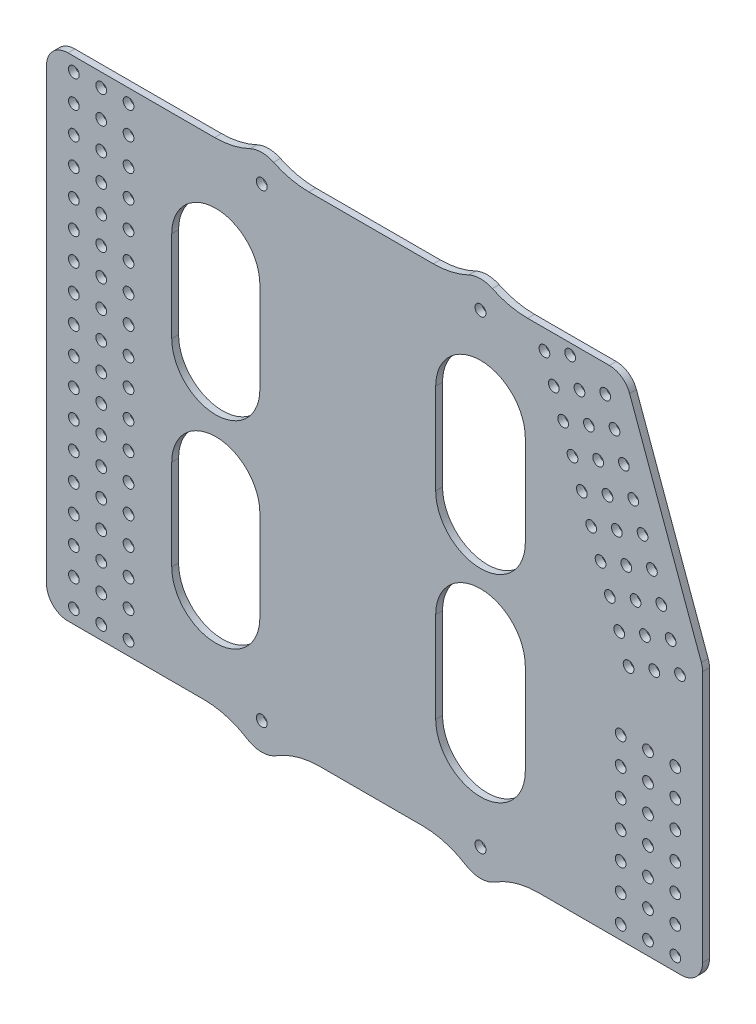
from build123d import *

# Parameters (mm, degrees)
SKETCH3_R           = 2.4892
SKETCH3_R_2         = 14.2875
BOSS_EXTRUDE3_DEPTH = 3.175
FILLET2_R           = 10
BOSS_EXTRUDE5_START = -3.175
SKETCH5_R           = 14.2875
SKETCH5_R_2         = 2.4892
BOSS_EXTRUDE5_DEPTH = 3.175
SKETCH6_R           = 2.54
CUT_EXTRUDE1_DEPTH  = 3.175
BOSS_EXTRUDE6_DEPTH = 3.175


with BuildPart() as part:
    # Sketch3 → Boss-Extrude3 (new body)
    with BuildSketch(Plane.XY):
        Polygon((-62.034734806, 275.060295422), (206.435304788, 275.060295422), (242.765265194, 175.244549557), (242.765265194, 46.460295422), (-62.034734806, 46.460295422), align=None)
        with Locations((123.22406409, 114.608841068)):
            Circle(SKETCH3_R, mode=Mode.SUBTRACT)
        with Locations(Location((87.05446409, 114.608841068, 0), (0, 0, 180))):
            Circle(SKETCH3_R, mode=Mode.SUBTRACT)
        with Locations((-49.334734806, 268.710295422)):
            Circle(SKETCH3_R, mode=Mode.SUBTRACT)
        with Locations((-49.334734806, 90.910295422)):
            Circle(SKETCH3_R, mode=Mode.SUBTRACT)
        with Locations((-36.634734806, 268.710295422)):
            Circle(SKETCH3_R, mode=Mode.SUBTRACT)
        with Locations((-23.934734806, 268.710295422)):
            Circle(SKETCH3_R, mode=Mode.SUBTRACT)
        with Locations((-36.634734806, 256.010295422)):
            Circle(SKETCH3_R, mode=Mode.SUBTRACT)
        with Locations((-23.934734806, 256.010295422)):
            Circle(SKETCH3_R, mode=Mode.SUBTRACT)
        with Locations((-36.634734806, 243.310295422)):
            Circle(SKETCH3_R, mode=Mode.SUBTRACT)
        with Locations((-23.934734806, 243.310295422)):
            Circle(SKETCH3_R, mode=Mode.SUBTRACT)
        with Locations((-36.634734806, 230.610295422)):
            Circle(SKETCH3_R, mode=Mode.SUBTRACT)
        with Locations((-23.934734806, 230.610295422)):
            Circle(SKETCH3_R, mode=Mode.SUBTRACT)
        with Locations((-36.634734806, 217.910295422)):
            Circle(SKETCH3_R, mode=Mode.SUBTRACT)
        with Locations((-23.934734806, 217.910295422)):
            Circle(SKETCH3_R, mode=Mode.SUBTRACT)
        with Locations((-36.634734806, 205.210295422)):
            Circle(SKETCH3_R, mode=Mode.SUBTRACT)
        with Locations((-23.934734806, 205.210295422)):
            Circle(SKETCH3_R, mode=Mode.SUBTRACT)
        with Locations((-36.634734806, 192.510295422)):
            Circle(SKETCH3_R, mode=Mode.SUBTRACT)
        with Locations((-23.934734806, 192.510295422)):
            Circle(SKETCH3_R, mode=Mode.SUBTRACT)
        with Locations((-36.634734806, 179.810295422)):
            Circle(SKETCH3_R, mode=Mode.SUBTRACT)
        with Locations((-23.934734806, 179.810295422)):
            Circle(SKETCH3_R, mode=Mode.SUBTRACT)
        with Locations((-36.634734806, 167.110295422)):
            Circle(SKETCH3_R, mode=Mode.SUBTRACT)
        with Locations((-23.934734806, 167.110295422)):
            Circle(SKETCH3_R, mode=Mode.SUBTRACT)
        with Locations((-36.634734806, 154.410295422)):
            Circle(SKETCH3_R, mode=Mode.SUBTRACT)
        with Locations((-23.934734806, 154.410295422)):
            Circle(SKETCH3_R, mode=Mode.SUBTRACT)
        with Locations((-36.634734806, 141.710295422)):
            Circle(SKETCH3_R, mode=Mode.SUBTRACT)
        with Locations((-23.934734806, 141.710295422)):
            Circle(SKETCH3_R, mode=Mode.SUBTRACT)
        with Locations((-36.634734806, 129.010295422)):
            Circle(SKETCH3_R, mode=Mode.SUBTRACT)
        with Locations((-23.934734806, 129.010295422)):
            Circle(SKETCH3_R, mode=Mode.SUBTRACT)
        with Locations((-36.634734806, 116.310295422)):
            Circle(SKETCH3_R, mode=Mode.SUBTRACT)
        with Locations((-23.934734806, 116.310295422)):
            Circle(SKETCH3_R, mode=Mode.SUBTRACT)
        with Locations((-36.634734806, 103.610295422)):
            Circle(SKETCH3_R, mode=Mode.SUBTRACT)
        with Locations((-23.934734806, 103.610295422)):
            Circle(SKETCH3_R, mode=Mode.SUBTRACT)
        with Locations((-36.634734806, 90.910295422)):
            Circle(SKETCH3_R, mode=Mode.SUBTRACT)
        with Locations((-23.934734806, 90.910295422)):
            Circle(SKETCH3_R, mode=Mode.SUBTRACT)
        with Locations((-49.334734806, 256.010295422)):
            Circle(SKETCH3_R, mode=Mode.SUBTRACT)
        with Locations((-49.334734806, 243.310295422)):
            Circle(SKETCH3_R, mode=Mode.SUBTRACT)
        with Locations((-49.334734806, 230.610295422)):
            Circle(SKETCH3_R, mode=Mode.SUBTRACT)
        with Locations((-49.334734806, 217.910295422)):
            Circle(SKETCH3_R, mode=Mode.SUBTRACT)
        with Locations((-49.334734806, 205.210295422)):
            Circle(SKETCH3_R, mode=Mode.SUBTRACT)
        with Locations((-49.334734806, 192.510295422)):
            Circle(SKETCH3_R, mode=Mode.SUBTRACT)
        with Locations((-49.334734806, 179.810295422)):
            Circle(SKETCH3_R, mode=Mode.SUBTRACT)
        with Locations((-49.334734806, 167.110295422)):
            Circle(SKETCH3_R, mode=Mode.SUBTRACT)
        with Locations((-49.334734806, 154.410295422)):
            Circle(SKETCH3_R, mode=Mode.SUBTRACT)
        with Locations((-49.334734806, 141.710295422)):
            Circle(SKETCH3_R, mode=Mode.SUBTRACT)
        with Locations((-49.334734806, 129.010295422)):
            Circle(SKETCH3_R, mode=Mode.SUBTRACT)
        with Locations((-49.334734806, 116.310295422)):
            Circle(SKETCH3_R, mode=Mode.SUBTRACT)
        with Locations((-49.334734806, 103.610295422)):
            Circle(SKETCH3_R, mode=Mode.SUBTRACT)
        with Locations((169.26865969, 265.77786594)):
            Circle(SKETCH3_R, mode=Mode.SUBTRACT)
        with Locations((181.202755974, 270.121521761)):
            Circle(SKETCH3_R, mode=Mode.SUBTRACT)
        with Locations((197.480508078, 262.531081297)):
            Circle(SKETCH3_R, mode=Mode.SUBTRACT)
        with Locations((173.61231551, 253.843769656)):
            Circle(SKETCH3_R, mode=Mode.SUBTRACT)
        with Locations((185.546411794, 258.187425477)):
            Circle(SKETCH3_R, mode=Mode.SUBTRACT)
        with Locations((201.824163899, 250.596985013)):
            Circle(SKETCH3_R, mode=Mode.SUBTRACT)
        with Locations((177.955971331, 241.909673372)):
            Circle(SKETCH3_R, mode=Mode.SUBTRACT)
        with Locations((189.890067615, 246.253329193)):
            Circle(SKETCH3_R, mode=Mode.SUBTRACT)
        with Locations((206.167819719, 238.662888729)):
            Circle(SKETCH3_R, mode=Mode.SUBTRACT)
        with Locations((182.299627151, 229.975577088)):
            Circle(SKETCH3_R, mode=Mode.SUBTRACT)
        with Locations((194.233723435, 234.319232909)):
            Circle(SKETCH3_R, mode=Mode.SUBTRACT)
        with Locations((210.511475539, 226.728792445)):
            Circle(SKETCH3_R, mode=Mode.SUBTRACT)
        with Locations((186.643282971, 218.041480804)):
            Circle(SKETCH3_R, mode=Mode.SUBTRACT)
        with Locations((198.577379255, 222.385136625)):
            Circle(SKETCH3_R, mode=Mode.SUBTRACT)
        with Locations((214.855131359, 214.794696161)):
            Circle(SKETCH3_R, mode=Mode.SUBTRACT)
        with Locations((190.986938791, 206.10738452)):
            Circle(SKETCH3_R, mode=Mode.SUBTRACT)
        with Locations((202.921035075, 210.451040341)):
            Circle(SKETCH3_R, mode=Mode.SUBTRACT)
        with Locations((219.19878718, 202.860599877)):
            Circle(SKETCH3_R, mode=Mode.SUBTRACT)
        with Locations((195.330594612, 194.173288236)):
            Circle(SKETCH3_R, mode=Mode.SUBTRACT)
        with Locations((207.264690896, 198.516944057)):
            Circle(SKETCH3_R, mode=Mode.SUBTRACT)
        with Locations((223.542443, 190.926503593)):
            Circle(SKETCH3_R, mode=Mode.SUBTRACT)
        with Locations((199.674250432, 182.239191952)):
            Circle(SKETCH3_R, mode=Mode.SUBTRACT)
        with Locations((211.608346716, 186.582847773)):
            Circle(SKETCH3_R, mode=Mode.SUBTRACT)
        with Locations((227.88609882, 178.992407309)):
            Circle(SKETCH3_R, mode=Mode.SUBTRACT)
        with Locations((204.017906252, 170.305095668)):
            Circle(SKETCH3_R, mode=Mode.SUBTRACT)
        with Locations((215.952002536, 174.648751489)):
            Circle(SKETCH3_R, mode=Mode.SUBTRACT)
        with Locations((232.22975464, 167.058311025)):
            Circle(SKETCH3_R, mode=Mode.SUBTRACT)
        with Locations((208.361562072, 158.370999384)):
            Circle(SKETCH3_R, mode=Mode.SUBTRACT)
        with Locations((220.295658356, 162.714655205)):
            Circle(SKETCH3_R, mode=Mode.SUBTRACT)
        with Locations((204.665265194, 129.010295422)):
            Circle(SKETCH3_R, mode=Mode.SUBTRACT)
        with Locations((217.365265194, 129.010295422)):
            Circle(SKETCH3_R, mode=Mode.SUBTRACT)
        with Locations((230.065265194, 129.010295422)):
            Circle(SKETCH3_R, mode=Mode.SUBTRACT)
        with Locations((204.665265194, 116.310295422)):
            Circle(SKETCH3_R, mode=Mode.SUBTRACT)
        with Locations((217.365265194, 116.310295422)):
            Circle(SKETCH3_R, mode=Mode.SUBTRACT)
        with Locations((230.065265194, 116.310295422)):
            Circle(SKETCH3_R, mode=Mode.SUBTRACT)
        with Locations((204.665265194, 103.610295422)):
            Circle(SKETCH3_R, mode=Mode.SUBTRACT)
        with Locations((217.365265194, 103.610295422)):
            Circle(SKETCH3_R, mode=Mode.SUBTRACT)
        with Locations((230.065265194, 103.610295422)):
            Circle(SKETCH3_R, mode=Mode.SUBTRACT)
        with Locations((204.665265194, 90.910295422)):
            Circle(SKETCH3_R, mode=Mode.SUBTRACT)
        with Locations((217.365265194, 90.910295422)):
            Circle(SKETCH3_R, mode=Mode.SUBTRACT)
        with Locations((230.065265194, 90.910295422)):
            Circle(SKETCH3_R, mode=Mode.SUBTRACT)
        with Locations((23.601611853, 185.85256672)):
            Circle(SKETCH3_R_2, mode=Mode.SUBTRACT)
        with Locations((52.142163008, 151.05639055)):
            Circle(SKETCH3_R_2, mode=Mode.SUBTRACT)
        with Locations((23.601611853, 116.25656672)):
            Circle(SKETCH3_R_2, mode=Mode.SUBTRACT)
        with Locations((105.13926409, 145.139641068)):
            Circle(SKETCH3_R_2, mode=Mode.SUBTRACT)
        with Locations((104.944740556, 224.82726801)):
            Circle(SKETCH3_R_2, mode=Mode.SUBTRACT)
        with Locations((144.142354475, 181.392565924)):
            Circle(SKETCH3_R_2, mode=Mode.SUBTRACT)
        with Locations((85.284021432, 241.01081705)):
            Circle(SKETCH3_R, mode=Mode.SUBTRACT)
        with Locations((23.601611853, 141.65656672)):
            Circle(SKETCH3_R, mode=Mode.SUBTRACT)
        with Locations((45.598657109, 128.95656672)):
            Circle(SKETCH3_R, mode=Mode.SUBTRACT)
        with Locations((45.598657109, 103.55656672)):
            Circle(SKETCH3_R, mode=Mode.SUBTRACT)
        with Locations((23.601611853, 90.85656672)):
            Circle(SKETCH3_R, mode=Mode.SUBTRACT)
        with Locations((1.604566597, 103.55656672)):
            Circle(SKETCH3_R, mode=Mode.SUBTRACT)
        with Locations((1.604566597, 128.95656672)):
            Circle(SKETCH3_R, mode=Mode.SUBTRACT)
        with Locations((23.601611853, 211.25256672)):
            Circle(SKETCH3_R, mode=Mode.SUBTRACT)
        with Locations((45.598657109, 198.55256672)):
            Circle(SKETCH3_R, mode=Mode.SUBTRACT)
        with Locations((45.598657109, 173.15256672)):
            Circle(SKETCH3_R, mode=Mode.SUBTRACT)
        with Locations((23.601611853, 160.45256672)):
            Circle(SKETCH3_R, mode=Mode.SUBTRACT)
        with Locations((1.604566597, 173.15256672)):
            Circle(SKETCH3_R, mode=Mode.SUBTRACT)
        with Locations((1.604566597, 198.55256672)):
            Circle(SKETCH3_R, mode=Mode.SUBTRACT)
        with Locations(Location((123.22406409, 175.670441068, 0), (0, 0, 180))):
            Circle(SKETCH3_R, mode=Mode.SUBTRACT)
        with Locations((87.05446409, 175.670441068)):
            Circle(SKETCH3_R, mode=Mode.SUBTRACT)
        with Locations((124.606520638, 208.84902209)):
            Circle(SKETCH3_R, mode=Mode.SUBTRACT)
        with Locations((-49.334734806, 78.210295422)):
            Circle(SKETCH3_R, mode=Mode.SUBTRACT)
        with Locations((-36.634734806, 78.210295422)):
            Circle(SKETCH3_R, mode=Mode.SUBTRACT)
        with Locations((-23.934734806, 78.210295422)):
            Circle(SKETCH3_R, mode=Mode.SUBTRACT)
        with Locations((-49.334734806, 65.510295422)):
            Circle(SKETCH3_R, mode=Mode.SUBTRACT)
        with Locations((-36.634734806, 65.510295422)):
            Circle(SKETCH3_R, mode=Mode.SUBTRACT)
        with Locations((-23.934734806, 65.510295422)):
            Circle(SKETCH3_R, mode=Mode.SUBTRACT)
        with Locations((-49.334734806, 52.810295422)):
            Circle(SKETCH3_R, mode=Mode.SUBTRACT)
        with Locations((-36.634734806, 52.810295422)):
            Circle(SKETCH3_R, mode=Mode.SUBTRACT)
        with Locations((-23.934734806, 52.810295422)):
            Circle(SKETCH3_R, mode=Mode.SUBTRACT)
        with Locations((204.665265194, 78.210295422)):
            Circle(SKETCH3_R, mode=Mode.SUBTRACT)
        with Locations((217.365265194, 78.210295422)):
            Circle(SKETCH3_R, mode=Mode.SUBTRACT)
        with Locations((230.065265194, 78.210295422)):
            Circle(SKETCH3_R, mode=Mode.SUBTRACT)
        with Locations((204.665265194, 65.510295422)):
            Circle(SKETCH3_R, mode=Mode.SUBTRACT)
        with Locations((217.365265194, 65.510295422)):
            Circle(SKETCH3_R, mode=Mode.SUBTRACT)
        with Locations((230.065265194, 65.510295422)):
            Circle(SKETCH3_R, mode=Mode.SUBTRACT)
        with Locations((204.665265194, 52.810295422)):
            Circle(SKETCH3_R, mode=Mode.SUBTRACT)
        with Locations((217.365265194, 52.810295422)):
            Circle(SKETCH3_R, mode=Mode.SUBTRACT)
        with Locations((230.065265194, 52.810295422)):
            Circle(SKETCH3_R, mode=Mode.SUBTRACT)
    extrude(amount=BOSS_EXTRUDE3_DEPTH)

    # Fillet2
    fillet2_edges = [part.edges().sort_by_distance(p)[0] for p in [
        (-62.034734806, 275.060295422, 1.5875),
        (206.435304788, 275.060295422, 1.5875),
        (242.765265194, 175.244549557, 1.5875),
        (242.765265194, 46.460295422, 1.5875),
        (-62.034734806, 46.460295422, 1.5875),
    ]]
    fillet(fillet2_edges, radius=FILLET2_R)

    # Sketch5 → Boss-Extrude5 (add)
    with BuildSketch(Plane.XY.offset(3.175).offset(BOSS_EXTRUDE5_START)):
        with Locations((23.601611853, 185.85256672)):
            Circle(SKETCH5_R)
        with Locations((23.601611853, 211.25256672)):
            Circle(SKETCH5_R_2)
        with Locations((45.598657109, 198.55256672)):
            Circle(SKETCH5_R_2)
        with Locations((1.604566597, 198.55256672)):
            Circle(SKETCH5_R_2)
        with Locations((1.604566597, 173.15256672)):
            Circle(SKETCH5_R_2)
        with Locations((23.601611853, 160.45256672)):
            Circle(SKETCH5_R_2)
        with Locations((45.598657109, 173.15256672)):
            Circle(SKETCH5_R_2)
        with Locations((23.601611853, 116.25656672)):
            Circle(SKETCH5_R)
        with Locations((1.604566597, 128.95656672)):
            Circle(SKETCH5_R_2)
        with Locations((23.601611853, 141.65656672)):
            Circle(SKETCH5_R_2)
        with Locations((45.598657109, 128.95656672)):
            Circle(SKETCH5_R_2)
        with Locations((1.604566597, 103.55656672)):
            Circle(SKETCH5_R_2)
        with Locations((23.601611853, 90.85656672)):
            Circle(SKETCH5_R_2)
        with Locations((45.598657109, 103.55656672)):
            Circle(SKETCH5_R_2)
        with Locations((52.142163008, 151.05639055)):
            Circle(SKETCH5_R)
        with Locations((105.13926409, 145.139641068)):
            Circle(SKETCH5_R)
        with Locations((87.05446409, 114.608841068)):
            Circle(SKETCH5_R_2)
        with Locations((123.22406409, 114.608841068)):
            Circle(SKETCH5_R_2)
        with Locations((87.05446409, 175.670441068)):
            Circle(SKETCH5_R_2)
        with Locations((123.22406409, 175.670441068)):
            Circle(SKETCH5_R_2)
        with Locations((144.142354475, 181.392565924)):
            Circle(SKETCH5_R)
        with Locations((104.944740556, 224.82726801)):
            Circle(SKETCH5_R)
        with Locations((124.606520638, 208.84902209)):
            Circle(SKETCH5_R_2)
        with Locations((85.284021432, 241.01081705)):
            Circle(SKETCH5_R_2)
    extrude(amount=BOSS_EXTRUDE5_DEPTH)

    # Sketch6 → Cut-Extrude1 (cut)
    with BuildSketch(Plane.XY.offset(3.175)):
        with Locations((37.965265194, 267.319051793)):
            Circle(SKETCH6_R)
        with Locations((139.565265194, 267.319051793)):
            Circle(SKETCH6_R)
        with Locations(Location((139.565265194, 51.419051793, 0), (0, 0, 180))):
            Circle(SKETCH6_R)
        with Locations(Location((37.965265194, 51.419051793, 0), (0, 0, 180))):
            Circle(SKETCH6_R)
        with BuildLine():
            Line((-3.86420078, 184.234054626), (-3.86420078, 226.372258652))
            ThreePointArc((-3.86420078, 226.372258652), (16.60292689, 246.839386322), (37.070054559, 226.372258652))
            Line((37.070054559, 226.372258652), (37.070054559, 184.234054626))
            ThreePointArc((37.070054559, 184.234054626), (16.60292689, 163.766926957), (-3.86420078, 184.234054626))
        make_face()
        with BuildLine():
            Line((118.756182344, 184.234054626), (118.756182344, 226.372258652))
            ThreePointArc((118.756182344, 226.372258652), (139.565265194, 247.181341502), (160.374348044, 226.372258652))
            Line((160.374348044, 226.372258652), (160.374348044, 184.234054626))
            ThreePointArc((160.374348044, 184.234054626), (139.565265194, 163.424971777), (118.756182344, 184.234054626))
        make_face()
        with BuildLine():
            Line((118.756182344, 134.504048959), (118.756182344, 92.365844933))
            ThreePointArc((118.756182344, 92.365844933), (139.565265194, 71.556762084), (160.374348044, 92.365844933))
            Line((160.374348044, 92.365844933), (160.374348044, 134.504048959))
            ThreePointArc((160.374348044, 134.504048959), (139.565265194, 155.313131809), (118.756182344, 134.504048959))
        make_face()
        with BuildLine():
            Line((-3.86420078, 134.504048959), (-3.86420078, 92.365844933))
            ThreePointArc((-3.86420078, 92.365844933), (16.60292689, 71.898717264), (37.070054559, 92.365844933))
            Line((37.070054559, 92.365844933), (37.070054559, 134.504048959))
            ThreePointArc((37.070054559, 134.504048959), (16.60292689, 154.971176629), (-3.86420078, 134.504048959))
        make_face()
    extrude(amount=-CUT_EXTRUDE1_DEPTH, mode=Mode.SUBTRACT)

    # Sketch7 → Boss-Extrude6 (add)
    with BuildSketch(Plane.XY.offset(3.175)):
        with BuildLine():
            ThreePointArc((43.438040898, 278.7793627), (51.43922885, 276.001692537), (59.85636801, 275.060295422))
            Line((59.85636801, 275.060295422), (16.074162378, 275.060295422))
            ThreePointArc((16.074162378, 275.060295422), (24.491301538, 276.001692537), (32.49248949, 278.7793627))
            ThreePointArc((32.49248949, 278.7793627), (37.965265194, 280.019051793), (43.438040898, 278.7793627))
        make_face()
        with BuildLine():
            ThreePointArc((145.038040898, 278.7793627), (153.03922885, 276.001692537), (161.45636801, 275.060295422))
            Line((161.45636801, 275.060295422), (117.674162378, 275.060295422))
            ThreePointArc((117.674162378, 275.060295422), (126.091301538, 276.001692537), (134.09248949, 278.7793627))
            ThreePointArc((134.09248949, 278.7793627), (139.565265194, 280.019051793), (145.038040898, 278.7793627))
        make_face()
        with BuildLine():
            ThreePointArc((31.226461981, 40.6543627), (37.965265194, 38.719051793), (44.704068407, 40.6543627))
            ThreePointArc((44.704068407, 40.6543627), (54.403681082, 44.980057596), (64.920478045, 46.460295422))
            Line((64.920478045, 46.460295422), (11.010052343, 46.460295422))
            ThreePointArc((11.010052343, 46.460295422), (21.526849306, 44.980057596), (31.226461981, 40.6543627))
        make_face()
        with BuildLine():
            ThreePointArc((132.826461981, 40.6543627), (139.565265194, 38.719051793), (146.304068407, 40.6543627))
            ThreePointArc((146.304068407, 40.6543627), (156.003681082, 44.980057596), (166.520478045, 46.460295422))
            Line((166.520478045, 46.460295422), (112.610052343, 46.460295422))
            ThreePointArc((112.610052343, 46.460295422), (123.126849306, 44.980057596), (132.826461981, 40.6543627))
        make_face()
    extrude(amount=-BOSS_EXTRUDE6_DEPTH)


solid = part.part
